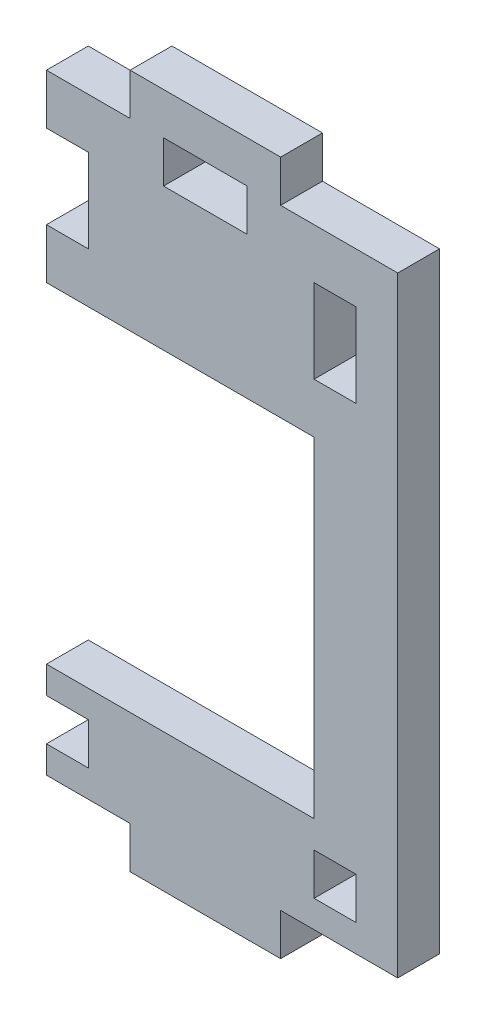
from build123d import *

# Parameters (mm, degrees)
BOSS_EXTRU_1_DEPTH      = 5
ESQUISSE2_W             = 5
ESQUISSE2_H             = 10
ESQUISSE2_H_2           = 5
ESQUISSE2_W_2           = 10
ENL_V_MAT_EXTRU_1_DEPTH = 5
ESQUISSE3_W             = 18
ESQUISSE3_H             = 5
BOSS_EXTRU_2_DEPTH      = 5


with BuildPart() as part:
    # Esquisse1 → Boss.-Extru.1 (new body)
    with BuildSketch(Plane.XY):
        Polygon((0, 73), (42, 73), (42, 0), (0, 0), (0, 11.5), (32, 11.5), (32, 51), (0, 51), align=None)
    extrude(amount=BOSS_EXTRU_1_DEPTH)

    # Esquisse2 → Enlèv. mat.-Extru.1 (cut)
    with BuildSketch(Plane.XY.offset(5)):
        with Locations((2.5, 62)):
            Rectangle(ESQUISSE2_W, ESQUISSE2_H)
        with Locations((2.5, 5.75)):
            Rectangle(ESQUISSE2_W, ESQUISSE2_H_2)
        with Locations((34.5, 62)):
            Rectangle(ESQUISSE2_W, ESQUISSE2_H)
        with Locations((34.5, 5.75)):
            Rectangle(ESQUISSE2_W, ESQUISSE2_H_2)
        with Locations((19, 70.5)):
            Rectangle(ESQUISSE2_W_2, ESQUISSE2_H_2)
    extrude(amount=-ENL_V_MAT_EXTRU_1_DEPTH, mode=Mode.SUBTRACT)

    # Esquisse3 → Boss.-Extru.2 (add)
    with BuildSketch(Plane.XY.offset(5)):
        with Locations((19, 75.5)):
            Rectangle(ESQUISSE3_W, ESQUISSE3_H)
        with Locations((19, -2.5)):
            Rectangle(ESQUISSE3_W, ESQUISSE3_H)
    extrude(amount=-BOSS_EXTRU_2_DEPTH)


solid = part.part
